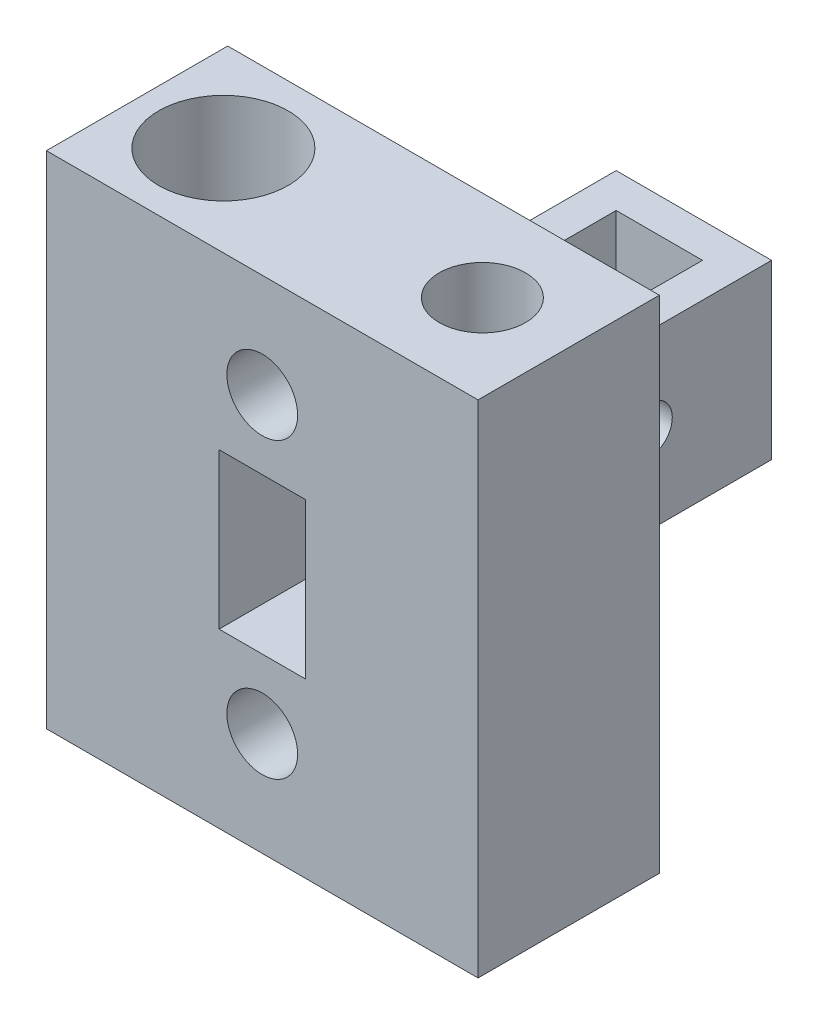
from build123d import *

# Parameters (mm, degrees)
SKETCH1_W           = 50
SKETCH1_H           = 21
BOSS_EXTRUDE1_DEPTH = 58
SKETCH3_R           = 7.5
CUT_EXTRUDE1_DEPTH  = 24
CUT_EXTRUDE2_REACH  = 66.025
SKETCH4_R           = 5
CUT_EXTRUDE3_START  = -24
SKETCH5_R           = 7.5
CUT_EXTRUDE3_DEPTH  = 24
CUT_EXTRUDE4_REACH  = 66.025
SKETCH6_R           = 4.5
CUT_EXTRUDE5_REACH  = 68.558
SKETCH8_W           = 10
SKETCH8_H           = 18
SKETCH7_R           = 4.1
CUT_EXTRUDE6_DEPTH  = 15
BOSS_EXTRUDE2_DEPTH = 25
SKETCH12_W          = 18
SKETCH12_H          = 20
BOSS_EXTRUDE3_DEPTH = 4
CUT_EXTRUDE7_DEPTH  = 78.975957833


with BuildPart() as part:
    # Sketch1 → Boss-Extrude1 (new body)
    with BuildSketch(Plane(origin=(0, 0, 0), x_dir=(1, 0, 0), z_dir=(0, 1, 0))):
        Rectangle(SKETCH1_W, SKETCH1_H)
    extrude(amount=BOSS_EXTRUDE1_DEPTH)

    # Sketch3 → Cut-Extrude1 (cut)
    with BuildSketch(Plane(origin=(0, 58, 0), x_dir=(1, 0, 0), z_dir=(0, 1, 0))):
        with Locations(Location((-15, 0, 0), (0, 0, 270))):
            Circle(SKETCH3_R)
    extrude(amount=-CUT_EXTRUDE1_DEPTH, mode=Mode.SUBTRACT)

    # Sketch4 → Cut-Extrude2 (cut, up to next)
    with BuildSketch(Plane(origin=(0, 58, 0), x_dir=(1, 0, 0), z_dir=(0, 1, 0)), mode=Mode.PRIVATE) as cut_extrude2_sk1:
        with Locations(Location((15, 0, 0), (0, 0, 270))):
            Circle(SKETCH4_R)
    cut_extrude2_tool1 = extrude(cut_extrude2_sk1.sketch, amount=-CUT_EXTRUDE2_REACH, mode=Mode.PRIVATE) & part.part
    add(cut_extrude2_tool1.solids().sort_by_distance((15, 58, 0))[0], mode=Mode.SUBTRACT)

    # Sketch5 → Cut-Extrude3 (cut)
    with BuildSketch(Plane.XZ.offset(CUT_EXTRUDE3_START)):
        with Locations(Location((-15, 0, 0), (0, 0, 90))):
            Circle(SKETCH5_R)
    extrude(amount=CUT_EXTRUDE3_DEPTH, mode=Mode.SUBTRACT)

    # Sketch6 → Cut-Extrude4 (cut, up to next)
    with BuildSketch(Plane.XZ, mode=Mode.PRIVATE) as cut_extrude4_sk1:
        with Locations(Location((-15, 0, 0), (0, 0, 270))):
            Circle(SKETCH6_R)
    cut_extrude4_tool1 = extrude(cut_extrude4_sk1.sketch, amount=-CUT_EXTRUDE4_REACH, mode=Mode.PRIVATE) & part.part
    add(cut_extrude4_tool1.solids().sort_by_distance((-15, 0, 0))[0], mode=Mode.SUBTRACT)

    # Sketch8 → Cut-Extrude5 (cut, up to next)
    with BuildSketch(Plane.XY.offset(10.5), mode=Mode.PRIVATE) as cut_extrude5_sk1:
        with Locations((0, 29)):
            Rectangle(SKETCH8_W, SKETCH8_H)
    cut_extrude5_tool1 = extrude(cut_extrude5_sk1.sketch, amount=-CUT_EXTRUDE5_REACH, mode=Mode.PRIVATE) & part.part
    add(cut_extrude5_tool1.solids().sort_by_distance((0, 29, 10.5))[0], mode=Mode.SUBTRACT)

    # Sketch7 → Cut-Extrude6 (cut)
    with BuildSketch(Plane.XY.offset(10.5)):
        with Locations((0, 46)):
            Circle(SKETCH7_R)
        with Locations(Location((0, 12, 0), (0, 0, 180))):
            Circle(SKETCH7_R)
    extrude(amount=-CUT_EXTRUDE6_DEPTH, mode=Mode.SUBTRACT)

    # Sketch11 → Boss-Extrude2 (add)
    with BuildSketch(Plane(origin=(0, 0, -10.5), x_dir=(-1, 0, 0), z_dir=(0, 0, -1))):
        Polygon((9, 19), (9, 39), (5, 39), (5, 38), (5, 20), (5, 19), align=None)
        Polygon((-9, 39), (-9, 19), (-5, 19), (-5, 20), (-5, 38), (-5, 39), align=None)
    extrude(amount=BOSS_EXTRUDE2_DEPTH)

    # Sketch12 → Boss-Extrude3 (add)
    with BuildSketch(Plane(origin=(0, 0, -35.5), x_dir=(-1, 0, 0), z_dir=(0, 0, -1))):
        with Locations((0, 29)):
            Rectangle(SKETCH12_W, SKETCH12_H)
    extrude(amount=BOSS_EXTRUDE3_DEPTH)

    # Sketch13 → Cut-Extrude7 (cut, through all)
    with BuildSketch(Plane(origin=(9, 0, 0), x_dir=(0, 0, -1), z_dir=(1, 0, 0))):
        with BuildLine():
            Line((16.25, 31.75), (25.25, 31.75))
            ThreePointArc((25.25, 31.75), (28, 29), (25.25, 26.25))
            Line((25.25, 26.25), (16.25, 26.25))
            ThreePointArc((16.25, 26.25), (13.5, 29), (16.25, 31.75))
        make_face()
    extrude(amount=-CUT_EXTRUDE7_DEPTH, mode=Mode.SUBTRACT)


solid = part.part
